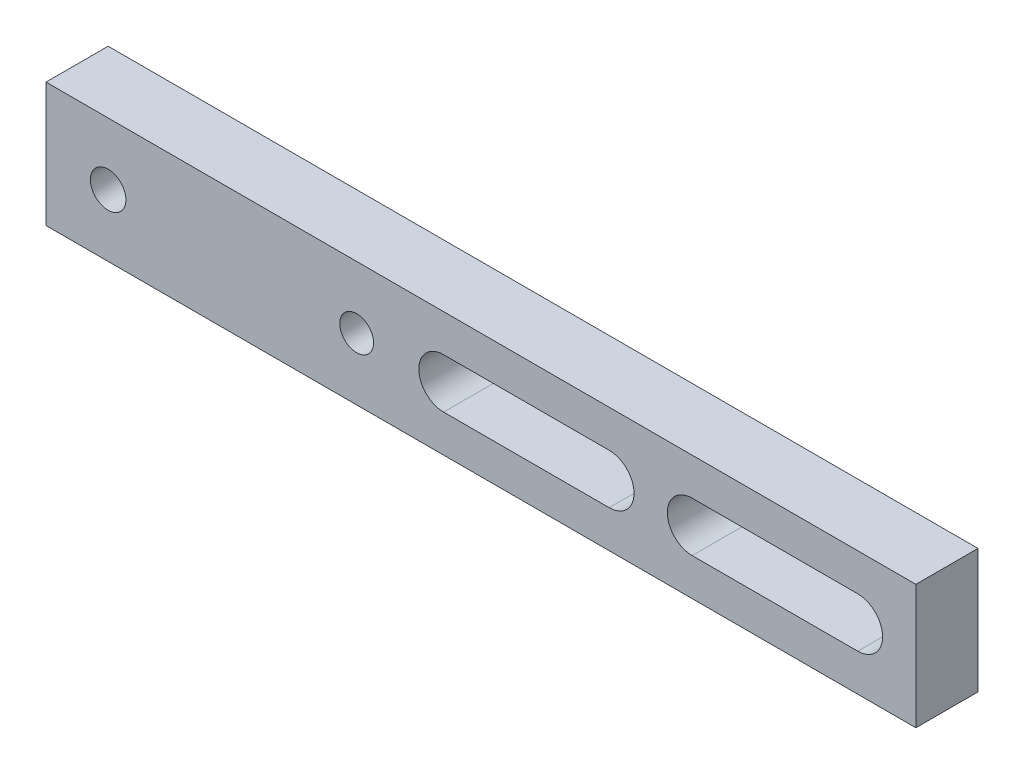
from build123d import *

# Parameters (mm, degrees)
SKETCH1_W           = 88.9
SKETCH1_H           = 12.7
BOSS_EXTRUDE1_DEPTH = 6.35
SKETCH3_R           = 1.729482421
SKETCH3_R_2         = 1.816224302
CUT_EXTRUDE1_DEPTH  = 6.35


with BuildPart() as part:
    # Sketch1 → Boss-Extrude1 (new body)
    with BuildSketch(Plane.XY):
        with Locations((34.234782609, 12.285869565)):
            Rectangle(SKETCH1_W, SKETCH1_H)
    extrude(amount=BOSS_EXTRUDE1_DEPTH)

    # Sketch3 → Cut-Extrude1 (cut)
    with BuildSketch(Plane.XY.offset(6.35)):
        with Locations((21.534782609, 12.285869565)):
            Circle(SKETCH3_R)
        with Locations((-3.865217391, 12.285869565)):
            Circle(SKETCH3_R_2)
        with BuildLine():
            Line((55.824782609, 14.825869565), (72.741182609, 14.825869565))
            ThreePointArc((72.741182609, 14.825869565), (75.281182609, 12.285869565), (72.741182609, 9.745869565))
            Line((72.741182609, 9.745869565), (55.824782609, 9.745869565))
            ThreePointArc((55.824782609, 9.745869565), (53.284782609, 12.285869565), (55.824782609, 14.825869565))
        make_face()
        with BuildLine():
            Line((47.341182609, 9.745869565), (30.424782609, 9.745869565))
            ThreePointArc((30.424782609, 9.745869565), (27.884782609, 12.285869565), (30.424782609, 14.825869565))
            Line((30.424782609, 14.825869565), (47.341182609, 14.825869565))
            ThreePointArc((47.341182609, 14.825869565), (49.881182609, 12.285869565), (47.341182609, 9.745869565))
        make_face()
    extrude(amount=-CUT_EXTRUDE1_DEPTH, mode=Mode.SUBTRACT)


solid = part.part
